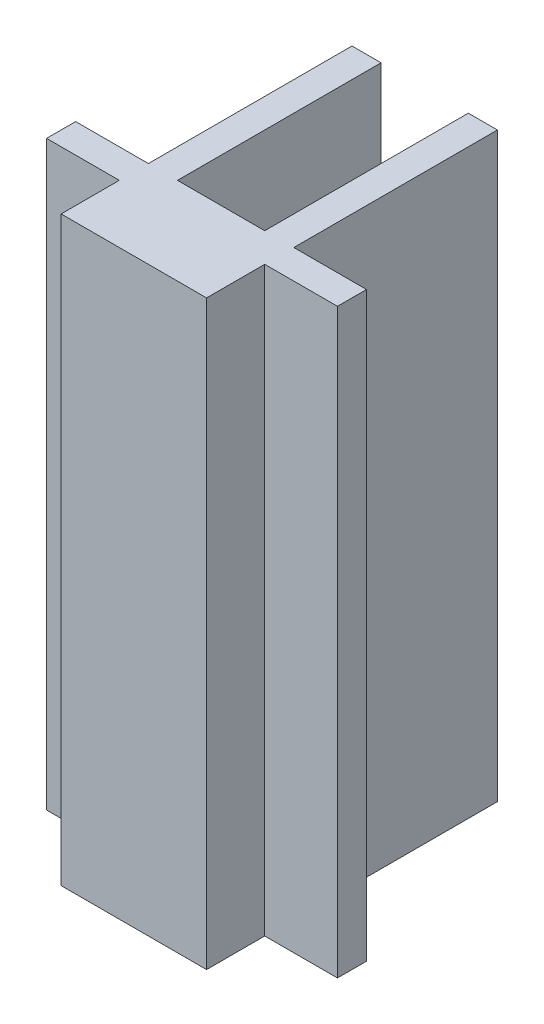
from build123d import *

# Parameters (mm, degrees)
SKETCH_1_W      = 10
SKETCH_1_H      = 10
SKETCH_1_W_2    = 25
EXTRUDE_1_DEPTH = 200


with BuildPart() as part:
    # Эскиз1 → Бобышка-Вытянуть1 (new body)
    with BuildSketch(Plane(origin=(0, 0, 0), x_dir=(1, 0, 0), z_dir=(0, 1, 0))):
        Polygon((-5, 40), (-5, 2), (0, 40), align=None)
        Polygon((0, 40), (-5, 2), (-5, -30), (5, -30), (5, 40), align=None)
        with Locations((0, -35)):
            Rectangle(SKETCH_1_W, SKETCH_1_H)
        Polygon((-5, -40), (-5, -30), (-20, -30), (-20, -60), (5, -60), (5, -40), align=None)
        with Locations((17.5, -35)):
            Rectangle(SKETCH_1_W_2, SKETCH_1_H)
    extrude_1 = extrude(amount=EXTRUDE_1_DEPTH)

    # Зеркальное отражение1: Бобышка-Вытянуть1 across plane
    add(extrude_1.mirror(Plane(origin=(-20, 200, 30), x_dir=(0, 0, 1), z_dir=(1, 0, 0))))


solid = part.part
